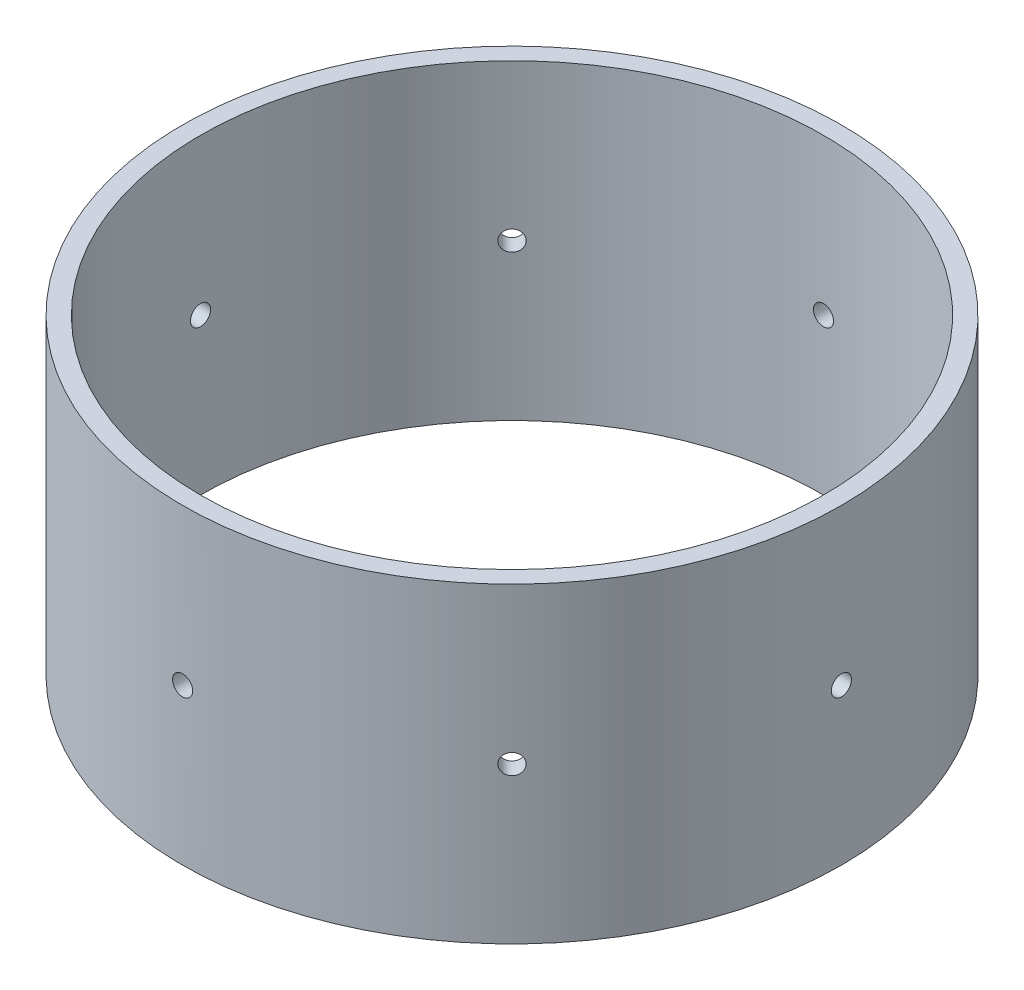
from build123d import *

# Parameters (mm, degrees)
SKETCH1_R               = 53.721
SKETCH1_R_2             = 50.8
EXTRUDE_THIN1_DEPTH     = 50.8
CUT_EXTRUDE1_REACH      = 132.424
CUT_EXTRUDE1_END_RADIUS = 50.8
SKETCH2_R               = 1.6383
CIRPATTERN1_COUNT       = 8


with BuildPart() as part:
    # Sketch1 → Extrude-Thin1 (new body)
    with BuildSketch(Plane(origin=(0, 0, 0), x_dir=(1, 0, 0), z_dir=(0, 1, 0))):
        Circle(SKETCH1_R)
        Circle(SKETCH1_R_2, mode=Mode.SUBTRACT)
    extrude(amount=EXTRUDE_THIN1_DEPTH)

    # Cut-Extrude1: up to this cylinder (the profile starts outside it)
    cut_extrude1_end = Plane(origin=(0, 25.4, 0), z_dir=(0, -1, 0)) * Cylinder(CUT_EXTRUDE1_END_RADIUS, 367.448, mode=Mode.PRIVATE)
    # Sketch2 → Cut-Extrude1 (cut, up to the surface)
    with BuildSketch(Plane.XY.offset(53.721), mode=Mode.PRIVATE) as cut_extrude1_sk1:
        with Locations((0, 25.4)):
            Circle(SKETCH2_R)
    cut_extrude1_tool1 = extrude(cut_extrude1_sk1.sketch, amount=-CUT_EXTRUDE1_REACH, mode=Mode.PRIVATE) - cut_extrude1_end
    cut_extrude1 = cut_extrude1_tool1.solids().sort_by_distance((0, 25.4, 53.721))[0]
    add(cut_extrude1, mode=Mode.SUBTRACT)

    # CirPattern1: Cut-Extrude1 ×8 about axis
    cirpattern1_axis = Axis((0, 50.8, 0), (0, -1, 0))
    for i in range(1, CIRPATTERN1_COUNT):
        add(cut_extrude1.rotate(cirpattern1_axis, i * 360 / CIRPATTERN1_COUNT), mode=Mode.SUBTRACT)


solid = part.part
